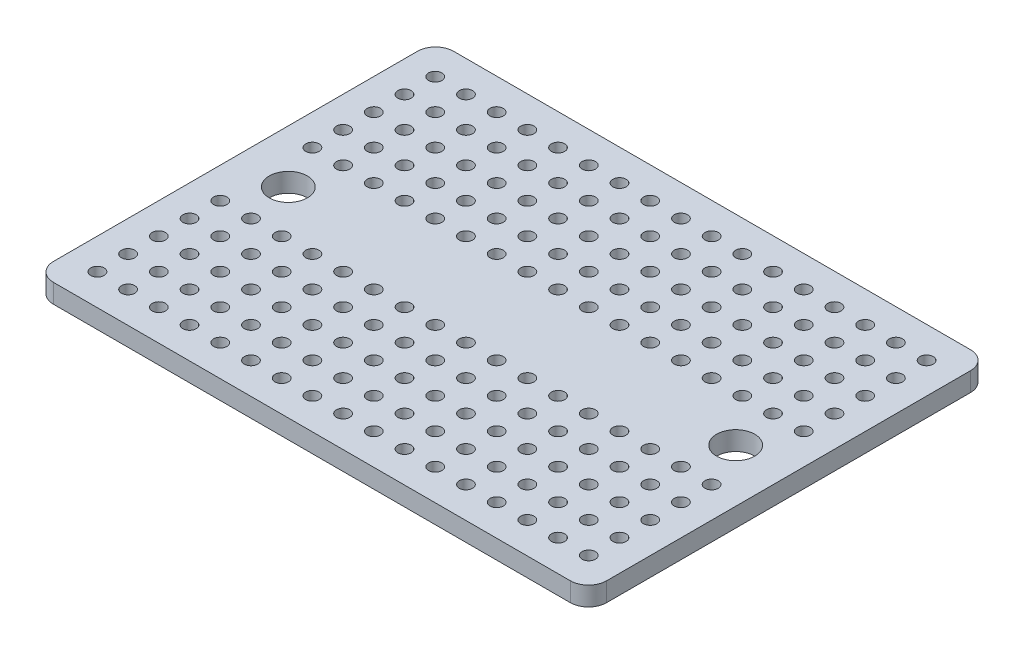
from build123d import *

# Parameters (mm, degrees)
SKETCH1_W           = 45.75
SKETCH1_H           = 33.1
SKETCH1_R           = 1.575
SKETCH1_R_2         = 0.55
BOSS_EXTRUDE1_DEPTH = 1.57
FILLET1_R           = 1.5


with BuildPart() as part:
    # Sketch1 → Boss-Extrude1 (new body)
    with BuildSketch(Plane(origin=(0, 0, 0), x_dir=(1, 0, 0), z_dir=(0, 1, 0))):
        Rectangle(SKETCH1_W, SKETCH1_H)
        with Locations(Location((-18.5, 0, 0), (0, 0, 270))):
            Circle(SKETCH1_R, mode=Mode.SUBTRACT)
        with Locations(Location((18.5, 0, 0), (0, 0, 90))):
            Circle(SKETCH1_R, mode=Mode.SUBTRACT)
        with Locations(Location((-20.32, 13.97, 0), (0, 0, 270))):
            Circle(SKETCH1_R_2, mode=Mode.SUBTRACT)
        with Locations(Location((-17.78, 13.97, 0), (0, 0, 270))):
            Circle(SKETCH1_R_2, mode=Mode.SUBTRACT)
        with Locations(Location((-15.24, 13.97, 0), (0, 0, 270))):
            Circle(SKETCH1_R_2, mode=Mode.SUBTRACT)
        with Locations(Location((-12.7, 13.97, 0), (0, 0, 270))):
            Circle(SKETCH1_R_2, mode=Mode.SUBTRACT)
        with Locations(Location((-10.16, 13.97, 0), (0, 0, 270))):
            Circle(SKETCH1_R_2, mode=Mode.SUBTRACT)
        with Locations(Location((-7.62, 13.97, 0), (0, 0, 270))):
            Circle(SKETCH1_R_2, mode=Mode.SUBTRACT)
        with Locations(Location((-5.08, 13.97, 0), (0, 0, 270))):
            Circle(SKETCH1_R_2, mode=Mode.SUBTRACT)
        with Locations(Location((-2.54, 13.97, 0), (0, 0, 270))):
            Circle(SKETCH1_R_2, mode=Mode.SUBTRACT)
        with Locations(Location((0, 13.97, 0), (0, 0, 270))):
            Circle(SKETCH1_R_2, mode=Mode.SUBTRACT)
        with Locations(Location((2.54, 13.97, 0), (0, 0, 270))):
            Circle(SKETCH1_R_2, mode=Mode.SUBTRACT)
        with Locations(Location((5.08, 13.97, 0), (0, 0, 270))):
            Circle(SKETCH1_R_2, mode=Mode.SUBTRACT)
        with Locations(Location((7.62, 13.97, 0), (0, 0, 270))):
            Circle(SKETCH1_R_2, mode=Mode.SUBTRACT)
        with Locations(Location((10.16, 13.97, 0), (0, 0, 270))):
            Circle(SKETCH1_R_2, mode=Mode.SUBTRACT)
        with Locations(Location((12.7, 13.97, 0), (0, 0, 270))):
            Circle(SKETCH1_R_2, mode=Mode.SUBTRACT)
        with Locations(Location((15.24, 13.97, 0), (0, 0, 270))):
            Circle(SKETCH1_R_2, mode=Mode.SUBTRACT)
        with Locations(Location((17.78, 13.97, 0), (0, 0, 270))):
            Circle(SKETCH1_R_2, mode=Mode.SUBTRACT)
        with Locations(Location((20.32, 13.97, 0), (0, 0, 270))):
            Circle(SKETCH1_R_2, mode=Mode.SUBTRACT)
        with Locations(Location((-17.78, 11.43, 0), (0, 0, 270))):
            Circle(SKETCH1_R_2, mode=Mode.SUBTRACT)
        with Locations(Location((-15.24, 11.43, 0), (0, 0, 270))):
            Circle(SKETCH1_R_2, mode=Mode.SUBTRACT)
        with Locations(Location((-12.7, 11.43, 0), (0, 0, 270))):
            Circle(SKETCH1_R_2, mode=Mode.SUBTRACT)
        with Locations(Location((-10.16, 11.43, 0), (0, 0, 270))):
            Circle(SKETCH1_R_2, mode=Mode.SUBTRACT)
        with Locations(Location((-7.62, 11.43, 0), (0, 0, 270))):
            Circle(SKETCH1_R_2, mode=Mode.SUBTRACT)
        with Locations(Location((-5.08, 11.43, 0), (0, 0, 270))):
            Circle(SKETCH1_R_2, mode=Mode.SUBTRACT)
        with Locations(Location((-2.54, 11.43, 0), (0, 0, 270))):
            Circle(SKETCH1_R_2, mode=Mode.SUBTRACT)
        with Locations(Location((0, 11.43, 0), (0, 0, 270))):
            Circle(SKETCH1_R_2, mode=Mode.SUBTRACT)
        with Locations(Location((2.54, 11.43, 0), (0, 0, 270))):
            Circle(SKETCH1_R_2, mode=Mode.SUBTRACT)
        with Locations(Location((5.08, 11.43, 0), (0, 0, 270))):
            Circle(SKETCH1_R_2, mode=Mode.SUBTRACT)
        with Locations(Location((7.62, 11.43, 0), (0, 0, 270))):
            Circle(SKETCH1_R_2, mode=Mode.SUBTRACT)
        with Locations(Location((10.16, 11.43, 0), (0, 0, 270))):
            Circle(SKETCH1_R_2, mode=Mode.SUBTRACT)
        with Locations(Location((12.7, 11.43, 0), (0, 0, 270))):
            Circle(SKETCH1_R_2, mode=Mode.SUBTRACT)
        with Locations(Location((15.24, 11.43, 0), (0, 0, 270))):
            Circle(SKETCH1_R_2, mode=Mode.SUBTRACT)
        with Locations(Location((17.78, 11.43, 0), (0, 0, 270))):
            Circle(SKETCH1_R_2, mode=Mode.SUBTRACT)
        with Locations(Location((20.32, 11.43, 0), (0, 0, 270))):
            Circle(SKETCH1_R_2, mode=Mode.SUBTRACT)
        with Locations(Location((-17.78, 8.89, 0), (0, 0, 270))):
            Circle(SKETCH1_R_2, mode=Mode.SUBTRACT)
        with Locations(Location((-15.24, 8.89, 0), (0, 0, 270))):
            Circle(SKETCH1_R_2, mode=Mode.SUBTRACT)
        with Locations(Location((-12.7, 8.89, 0), (0, 0, 270))):
            Circle(SKETCH1_R_2, mode=Mode.SUBTRACT)
        with Locations(Location((-10.16, 8.89, 0), (0, 0, 270))):
            Circle(SKETCH1_R_2, mode=Mode.SUBTRACT)
        with Locations(Location((-7.62, 8.89, 0), (0, 0, 270))):
            Circle(SKETCH1_R_2, mode=Mode.SUBTRACT)
        with Locations(Location((-5.08, 8.89, 0), (0, 0, 270))):
            Circle(SKETCH1_R_2, mode=Mode.SUBTRACT)
        with Locations(Location((-2.54, 8.89, 0), (0, 0, 270))):
            Circle(SKETCH1_R_2, mode=Mode.SUBTRACT)
        with Locations(Location((0, 8.89, 0), (0, 0, 270))):
            Circle(SKETCH1_R_2, mode=Mode.SUBTRACT)
        with Locations(Location((2.54, 8.89, 0), (0, 0, 270))):
            Circle(SKETCH1_R_2, mode=Mode.SUBTRACT)
        with Locations(Location((5.08, 8.89, 0), (0, 0, 270))):
            Circle(SKETCH1_R_2, mode=Mode.SUBTRACT)
        with Locations(Location((7.62, 8.89, 0), (0, 0, 270))):
            Circle(SKETCH1_R_2, mode=Mode.SUBTRACT)
        with Locations(Location((10.16, 8.89, 0), (0, 0, 270))):
            Circle(SKETCH1_R_2, mode=Mode.SUBTRACT)
        with Locations(Location((12.7, 8.89, 0), (0, 0, 270))):
            Circle(SKETCH1_R_2, mode=Mode.SUBTRACT)
        with Locations(Location((15.24, 8.89, 0), (0, 0, 270))):
            Circle(SKETCH1_R_2, mode=Mode.SUBTRACT)
        with Locations(Location((17.78, 8.89, 0), (0, 0, 270))):
            Circle(SKETCH1_R_2, mode=Mode.SUBTRACT)
        with Locations(Location((20.32, 8.89, 0), (0, 0, 270))):
            Circle(SKETCH1_R_2, mode=Mode.SUBTRACT)
        with Locations(Location((-17.78, 6.35, 0), (0, 0, 270))):
            Circle(SKETCH1_R_2, mode=Mode.SUBTRACT)
        with Locations(Location((-15.24, 6.35, 0), (0, 0, 270))):
            Circle(SKETCH1_R_2, mode=Mode.SUBTRACT)
        with Locations(Location((-12.7, 6.35, 0), (0, 0, 270))):
            Circle(SKETCH1_R_2, mode=Mode.SUBTRACT)
        with Locations(Location((-10.16, 6.35, 0), (0, 0, 270))):
            Circle(SKETCH1_R_2, mode=Mode.SUBTRACT)
        with Locations(Location((-7.62, 6.35, 0), (0, 0, 270))):
            Circle(SKETCH1_R_2, mode=Mode.SUBTRACT)
        with Locations(Location((-5.08, 6.35, 0), (0, 0, 270))):
            Circle(SKETCH1_R_2, mode=Mode.SUBTRACT)
        with Locations(Location((-2.54, 6.35, 0), (0, 0, 270))):
            Circle(SKETCH1_R_2, mode=Mode.SUBTRACT)
        with Locations(Location((0, 6.35, 0), (0, 0, 270))):
            Circle(SKETCH1_R_2, mode=Mode.SUBTRACT)
        with Locations(Location((2.54, 6.35, 0), (0, 0, 270))):
            Circle(SKETCH1_R_2, mode=Mode.SUBTRACT)
        with Locations(Location((5.08, 6.35, 0), (0, 0, 270))):
            Circle(SKETCH1_R_2, mode=Mode.SUBTRACT)
        with Locations(Location((7.62, 6.35, 0), (0, 0, 270))):
            Circle(SKETCH1_R_2, mode=Mode.SUBTRACT)
        with Locations(Location((10.16, 6.35, 0), (0, 0, 270))):
            Circle(SKETCH1_R_2, mode=Mode.SUBTRACT)
        with Locations(Location((12.7, 6.35, 0), (0, 0, 270))):
            Circle(SKETCH1_R_2, mode=Mode.SUBTRACT)
        with Locations(Location((15.24, 6.35, 0), (0, 0, 270))):
            Circle(SKETCH1_R_2, mode=Mode.SUBTRACT)
        with Locations(Location((17.78, 6.35, 0), (0, 0, 270))):
            Circle(SKETCH1_R_2, mode=Mode.SUBTRACT)
        with Locations(Location((20.32, 6.35, 0), (0, 0, 270))):
            Circle(SKETCH1_R_2, mode=Mode.SUBTRACT)
        with Locations(Location((-17.78, 3.81, 0), (0, 0, 270))):
            Circle(SKETCH1_R_2, mode=Mode.SUBTRACT)
        with Locations(Location((-15.24, 3.81, 0), (0, 0, 270))):
            Circle(SKETCH1_R_2, mode=Mode.SUBTRACT)
        with Locations(Location((-12.7, 3.81, 0), (0, 0, 270))):
            Circle(SKETCH1_R_2, mode=Mode.SUBTRACT)
        with Locations(Location((-10.16, 3.81, 0), (0, 0, 270))):
            Circle(SKETCH1_R_2, mode=Mode.SUBTRACT)
        with Locations(Location((-7.62, 3.81, 0), (0, 0, 270))):
            Circle(SKETCH1_R_2, mode=Mode.SUBTRACT)
        with Locations(Location((-5.08, 3.81, 0), (0, 0, 270))):
            Circle(SKETCH1_R_2, mode=Mode.SUBTRACT)
        with Locations(Location((-2.54, 3.81, 0), (0, 0, 270))):
            Circle(SKETCH1_R_2, mode=Mode.SUBTRACT)
        with Locations(Location((0, 3.81, 0), (0, 0, 270))):
            Circle(SKETCH1_R_2, mode=Mode.SUBTRACT)
        with Locations(Location((2.54, 3.81, 0), (0, 0, 270))):
            Circle(SKETCH1_R_2, mode=Mode.SUBTRACT)
        with Locations(Location((5.08, 3.81, 0), (0, 0, 270))):
            Circle(SKETCH1_R_2, mode=Mode.SUBTRACT)
        with Locations(Location((7.62, 3.81, 0), (0, 0, 270))):
            Circle(SKETCH1_R_2, mode=Mode.SUBTRACT)
        with Locations(Location((10.16, 3.81, 0), (0, 0, 270))):
            Circle(SKETCH1_R_2, mode=Mode.SUBTRACT)
        with Locations(Location((12.7, 3.81, 0), (0, 0, 270))):
            Circle(SKETCH1_R_2, mode=Mode.SUBTRACT)
        with Locations(Location((15.24, 3.81, 0), (0, 0, 270))):
            Circle(SKETCH1_R_2, mode=Mode.SUBTRACT)
        with Locations(Location((17.78, 3.81, 0), (0, 0, 270))):
            Circle(SKETCH1_R_2, mode=Mode.SUBTRACT)
        with Locations(Location((20.32, 3.81, 0), (0, 0, 270))):
            Circle(SKETCH1_R_2, mode=Mode.SUBTRACT)
        with Locations(Location((-17.78, -3.81, 0), (0, 0, 270))):
            Circle(SKETCH1_R_2, mode=Mode.SUBTRACT)
        with Locations(Location((-15.24, -3.81, 0), (0, 0, 270))):
            Circle(SKETCH1_R_2, mode=Mode.SUBTRACT)
        with Locations(Location((-12.7, -3.81, 0), (0, 0, 270))):
            Circle(SKETCH1_R_2, mode=Mode.SUBTRACT)
        with Locations(Location((-10.16, -3.81, 0), (0, 0, 270))):
            Circle(SKETCH1_R_2, mode=Mode.SUBTRACT)
        with Locations(Location((-7.62, -3.81, 0), (0, 0, 270))):
            Circle(SKETCH1_R_2, mode=Mode.SUBTRACT)
        with Locations(Location((-5.08, -3.81, 0), (0, 0, 270))):
            Circle(SKETCH1_R_2, mode=Mode.SUBTRACT)
        with Locations(Location((-2.54, -3.81, 0), (0, 0, 270))):
            Circle(SKETCH1_R_2, mode=Mode.SUBTRACT)
        with Locations(Location((0, -3.81, 0), (0, 0, 270))):
            Circle(SKETCH1_R_2, mode=Mode.SUBTRACT)
        with Locations(Location((2.54, -3.81, 0), (0, 0, 270))):
            Circle(SKETCH1_R_2, mode=Mode.SUBTRACT)
        with Locations(Location((5.08, -3.81, 0), (0, 0, 270))):
            Circle(SKETCH1_R_2, mode=Mode.SUBTRACT)
        with Locations(Location((7.62, -3.81, 0), (0, 0, 270))):
            Circle(SKETCH1_R_2, mode=Mode.SUBTRACT)
        with Locations(Location((10.16, -3.81, 0), (0, 0, 270))):
            Circle(SKETCH1_R_2, mode=Mode.SUBTRACT)
        with Locations(Location((12.7, -3.81, 0), (0, 0, 270))):
            Circle(SKETCH1_R_2, mode=Mode.SUBTRACT)
        with Locations(Location((15.24, -3.81, 0), (0, 0, 270))):
            Circle(SKETCH1_R_2, mode=Mode.SUBTRACT)
        with Locations(Location((17.78, -3.81, 0), (0, 0, 270))):
            Circle(SKETCH1_R_2, mode=Mode.SUBTRACT)
        with Locations(Location((20.32, -3.81, 0), (0, 0, 270))):
            Circle(SKETCH1_R_2, mode=Mode.SUBTRACT)
        with Locations(Location((-17.78, -6.35, 0), (0, 0, 270))):
            Circle(SKETCH1_R_2, mode=Mode.SUBTRACT)
        with Locations(Location((-15.24, -6.35, 0), (0, 0, 270))):
            Circle(SKETCH1_R_2, mode=Mode.SUBTRACT)
        with Locations(Location((-12.7, -6.35, 0), (0, 0, 270))):
            Circle(SKETCH1_R_2, mode=Mode.SUBTRACT)
        with Locations(Location((-10.16, -6.35, 0), (0, 0, 270))):
            Circle(SKETCH1_R_2, mode=Mode.SUBTRACT)
        with Locations(Location((-7.62, -6.35, 0), (0, 0, 270))):
            Circle(SKETCH1_R_2, mode=Mode.SUBTRACT)
        with Locations(Location((-5.08, -6.35, 0), (0, 0, 270))):
            Circle(SKETCH1_R_2, mode=Mode.SUBTRACT)
        with Locations(Location((-2.54, -6.35, 0), (0, 0, 270))):
            Circle(SKETCH1_R_2, mode=Mode.SUBTRACT)
        with Locations(Location((0, -6.35, 0), (0, 0, 270))):
            Circle(SKETCH1_R_2, mode=Mode.SUBTRACT)
        with Locations(Location((2.54, -6.35, 0), (0, 0, 270))):
            Circle(SKETCH1_R_2, mode=Mode.SUBTRACT)
        with Locations(Location((5.08, -6.35, 0), (0, 0, 270))):
            Circle(SKETCH1_R_2, mode=Mode.SUBTRACT)
        with Locations(Location((7.62, -6.35, 0), (0, 0, 270))):
            Circle(SKETCH1_R_2, mode=Mode.SUBTRACT)
        with Locations(Location((10.16, -6.35, 0), (0, 0, 270))):
            Circle(SKETCH1_R_2, mode=Mode.SUBTRACT)
        with Locations(Location((12.7, -6.35, 0), (0, 0, 270))):
            Circle(SKETCH1_R_2, mode=Mode.SUBTRACT)
        with Locations(Location((15.24, -6.35, 0), (0, 0, 270))):
            Circle(SKETCH1_R_2, mode=Mode.SUBTRACT)
        with Locations(Location((17.78, -6.35, 0), (0, 0, 270))):
            Circle(SKETCH1_R_2, mode=Mode.SUBTRACT)
        with Locations(Location((20.32, -6.35, 0), (0, 0, 270))):
            Circle(SKETCH1_R_2, mode=Mode.SUBTRACT)
        with Locations(Location((-17.78, -8.89, 0), (0, 0, 270))):
            Circle(SKETCH1_R_2, mode=Mode.SUBTRACT)
        with Locations(Location((-15.24, -8.89, 0), (0, 0, 270))):
            Circle(SKETCH1_R_2, mode=Mode.SUBTRACT)
        with Locations(Location((-12.7, -8.89, 0), (0, 0, 270))):
            Circle(SKETCH1_R_2, mode=Mode.SUBTRACT)
        with Locations(Location((-10.16, -8.89, 0), (0, 0, 270))):
            Circle(SKETCH1_R_2, mode=Mode.SUBTRACT)
        with Locations(Location((-7.62, -8.89, 0), (0, 0, 270))):
            Circle(SKETCH1_R_2, mode=Mode.SUBTRACT)
        with Locations(Location((-5.08, -8.89, 0), (0, 0, 270))):
            Circle(SKETCH1_R_2, mode=Mode.SUBTRACT)
        with Locations(Location((-2.54, -8.89, 0), (0, 0, 270))):
            Circle(SKETCH1_R_2, mode=Mode.SUBTRACT)
        with Locations(Location((0, -8.89, 0), (0, 0, 270))):
            Circle(SKETCH1_R_2, mode=Mode.SUBTRACT)
        with Locations(Location((2.54, -8.89, 0), (0, 0, 270))):
            Circle(SKETCH1_R_2, mode=Mode.SUBTRACT)
        with Locations(Location((5.08, -8.89, 0), (0, 0, 270))):
            Circle(SKETCH1_R_2, mode=Mode.SUBTRACT)
        with Locations(Location((7.62, -8.89, 0), (0, 0, 270))):
            Circle(SKETCH1_R_2, mode=Mode.SUBTRACT)
        with Locations(Location((10.16, -8.89, 0), (0, 0, 270))):
            Circle(SKETCH1_R_2, mode=Mode.SUBTRACT)
        with Locations(Location((12.7, -8.89, 0), (0, 0, 270))):
            Circle(SKETCH1_R_2, mode=Mode.SUBTRACT)
        with Locations(Location((15.24, -8.89, 0), (0, 0, 270))):
            Circle(SKETCH1_R_2, mode=Mode.SUBTRACT)
        with Locations(Location((17.78, -8.89, 0), (0, 0, 270))):
            Circle(SKETCH1_R_2, mode=Mode.SUBTRACT)
        with Locations(Location((20.32, -8.89, 0), (0, 0, 270))):
            Circle(SKETCH1_R_2, mode=Mode.SUBTRACT)
        with Locations(Location((-17.78, -11.43, 0), (0, 0, 270))):
            Circle(SKETCH1_R_2, mode=Mode.SUBTRACT)
        with Locations(Location((-15.24, -11.43, 0), (0, 0, 270))):
            Circle(SKETCH1_R_2, mode=Mode.SUBTRACT)
        with Locations(Location((-12.7, -11.43, 0), (0, 0, 270))):
            Circle(SKETCH1_R_2, mode=Mode.SUBTRACT)
        with Locations(Location((-10.16, -11.43, 0), (0, 0, 270))):
            Circle(SKETCH1_R_2, mode=Mode.SUBTRACT)
        with Locations(Location((-7.62, -11.43, 0), (0, 0, 270))):
            Circle(SKETCH1_R_2, mode=Mode.SUBTRACT)
        with Locations(Location((-5.08, -11.43, 0), (0, 0, 270))):
            Circle(SKETCH1_R_2, mode=Mode.SUBTRACT)
        with Locations(Location((-2.54, -11.43, 0), (0, 0, 270))):
            Circle(SKETCH1_R_2, mode=Mode.SUBTRACT)
        with Locations(Location((0, -11.43, 0), (0, 0, 270))):
            Circle(SKETCH1_R_2, mode=Mode.SUBTRACT)
        with Locations(Location((2.54, -11.43, 0), (0, 0, 270))):
            Circle(SKETCH1_R_2, mode=Mode.SUBTRACT)
        with Locations(Location((5.08, -11.43, 0), (0, 0, 270))):
            Circle(SKETCH1_R_2, mode=Mode.SUBTRACT)
        with Locations(Location((7.62, -11.43, 0), (0, 0, 270))):
            Circle(SKETCH1_R_2, mode=Mode.SUBTRACT)
        with Locations(Location((10.16, -11.43, 0), (0, 0, 270))):
            Circle(SKETCH1_R_2, mode=Mode.SUBTRACT)
        with Locations(Location((12.7, -11.43, 0), (0, 0, 270))):
            Circle(SKETCH1_R_2, mode=Mode.SUBTRACT)
        with Locations(Location((15.24, -11.43, 0), (0, 0, 270))):
            Circle(SKETCH1_R_2, mode=Mode.SUBTRACT)
        with Locations(Location((17.78, -11.43, 0), (0, 0, 270))):
            Circle(SKETCH1_R_2, mode=Mode.SUBTRACT)
        with Locations(Location((20.32, -11.43, 0), (0, 0, 270))):
            Circle(SKETCH1_R_2, mode=Mode.SUBTRACT)
        with Locations(Location((-17.78, -13.97, 0), (0, 0, 270))):
            Circle(SKETCH1_R_2, mode=Mode.SUBTRACT)
        with Locations(Location((-15.24, -13.97, 0), (0, 0, 270))):
            Circle(SKETCH1_R_2, mode=Mode.SUBTRACT)
        with Locations(Location((-12.7, -13.97, 0), (0, 0, 270))):
            Circle(SKETCH1_R_2, mode=Mode.SUBTRACT)
        with Locations(Location((-10.16, -13.97, 0), (0, 0, 270))):
            Circle(SKETCH1_R_2, mode=Mode.SUBTRACT)
        with Locations(Location((-7.62, -13.97, 0), (0, 0, 270))):
            Circle(SKETCH1_R_2, mode=Mode.SUBTRACT)
        with Locations(Location((-5.08, -13.97, 0), (0, 0, 270))):
            Circle(SKETCH1_R_2, mode=Mode.SUBTRACT)
        with Locations(Location((-2.54, -13.97, 0), (0, 0, 270))):
            Circle(SKETCH1_R_2, mode=Mode.SUBTRACT)
        with Locations(Location((0, -13.97, 0), (0, 0, 270))):
            Circle(SKETCH1_R_2, mode=Mode.SUBTRACT)
        with Locations(Location((2.54, -13.97, 0), (0, 0, 270))):
            Circle(SKETCH1_R_2, mode=Mode.SUBTRACT)
        with Locations(Location((5.08, -13.97, 0), (0, 0, 270))):
            Circle(SKETCH1_R_2, mode=Mode.SUBTRACT)
        with Locations(Location((7.62, -13.97, 0), (0, 0, 270))):
            Circle(SKETCH1_R_2, mode=Mode.SUBTRACT)
        with Locations(Location((10.16, -13.97, 0), (0, 0, 270))):
            Circle(SKETCH1_R_2, mode=Mode.SUBTRACT)
        with Locations(Location((12.7, -13.97, 0), (0, 0, 270))):
            Circle(SKETCH1_R_2, mode=Mode.SUBTRACT)
        with Locations(Location((15.24, -13.97, 0), (0, 0, 270))):
            Circle(SKETCH1_R_2, mode=Mode.SUBTRACT)
        with Locations(Location((17.78, -13.97, 0), (0, 0, 270))):
            Circle(SKETCH1_R_2, mode=Mode.SUBTRACT)
        with Locations(Location((20.32, -13.97, 0), (0, 0, 270))):
            Circle(SKETCH1_R_2, mode=Mode.SUBTRACT)
        with Locations(Location((-20.32, 11.43, 0), (0, 0, 270))):
            Circle(SKETCH1_R_2, mode=Mode.SUBTRACT)
        with Locations(Location((-20.32, 8.89, 0), (0, 0, 270))):
            Circle(SKETCH1_R_2, mode=Mode.SUBTRACT)
        with Locations(Location((-20.32, 6.35, 0), (0, 0, 270))):
            Circle(SKETCH1_R_2, mode=Mode.SUBTRACT)
        with Locations(Location((-20.32, 3.81, 0), (0, 0, 270))):
            Circle(SKETCH1_R_2, mode=Mode.SUBTRACT)
        with Locations(Location((-20.32, -3.81, 0), (0, 0, 270))):
            Circle(SKETCH1_R_2, mode=Mode.SUBTRACT)
        with Locations(Location((-20.32, -6.35, 0), (0, 0, 270))):
            Circle(SKETCH1_R_2, mode=Mode.SUBTRACT)
        with Locations(Location((-20.32, -8.89, 0), (0, 0, 270))):
            Circle(SKETCH1_R_2, mode=Mode.SUBTRACT)
        with Locations(Location((-20.32, -11.43, 0), (0, 0, 270))):
            Circle(SKETCH1_R_2, mode=Mode.SUBTRACT)
        with Locations(Location((-20.32, -13.97, 0), (0, 0, 270))):
            Circle(SKETCH1_R_2, mode=Mode.SUBTRACT)
    extrude(amount=BOSS_EXTRUDE1_DEPTH)

    # Fillet1
    fillet1_edges = [part.edges().sort_by_distance(p)[0] for p in [
        (22.875, 0.785, 16.55),
        (-22.875, 0.785, 16.55),
        (-22.875, 0.785, -16.55),
        (22.875, 0.785, -16.55),
    ]]
    fillet(fillet1_edges, radius=FILLET1_R)


solid = part.part
